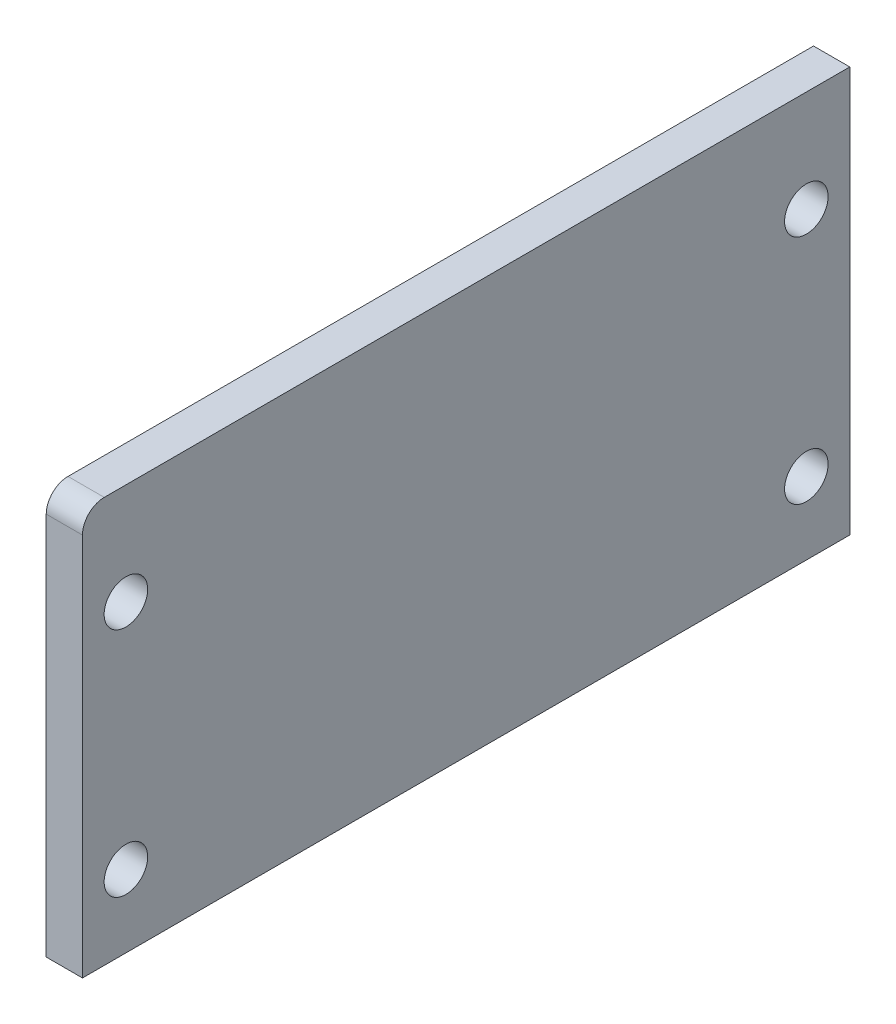
from build123d import *

# Parameters (mm, degrees)
BOSS_EXTRUDE1_DEPTH = 3.18
SKETCH2_R           = 1.91
CUT_EXTRUDE4_DEPTH  = 77.192270605


with BuildPart() as part:
    # Sketch1 → Boss-Extrude1 (new body)
    with BuildSketch(Plane(origin=(0, 0, 0), x_dir=(0, 0, -1), z_dir=(1, 0, 0))):
        with BuildLine():
            Line((0, 0), (-67.31, 0))
            Line((-67.31, 0), (-67.31, 33.65))
            ThreePointArc((-67.31, 33.65), (-66.750573952, 35.000573952), (-65.4, 35.56))
            Line((-65.4, 35.56), (0, 35.56))
            Line((0, 35.56), (0, 0))
        make_face()
    extrude(amount=BOSS_EXTRUDE1_DEPTH)

    # Sketch2 → Cut-Extrude4 (cut, through all)
    with BuildSketch(Plane(origin=(3.18, 0, 0), x_dir=(0, 0, -1), z_dir=(1, 0, 0))):
        with Locations((-63.5, 26.67)):
            Circle(SKETCH2_R)
        with Locations((-63.5, 6.35)):
            Circle(SKETCH2_R)
        with Locations((-3.81, 6.35)):
            Circle(SKETCH2_R)
        with Locations((-3.81, 26.67)):
            Circle(SKETCH2_R)
    extrude(amount=-CUT_EXTRUDE4_DEPTH, mode=Mode.SUBTRACT)


solid = part.part
